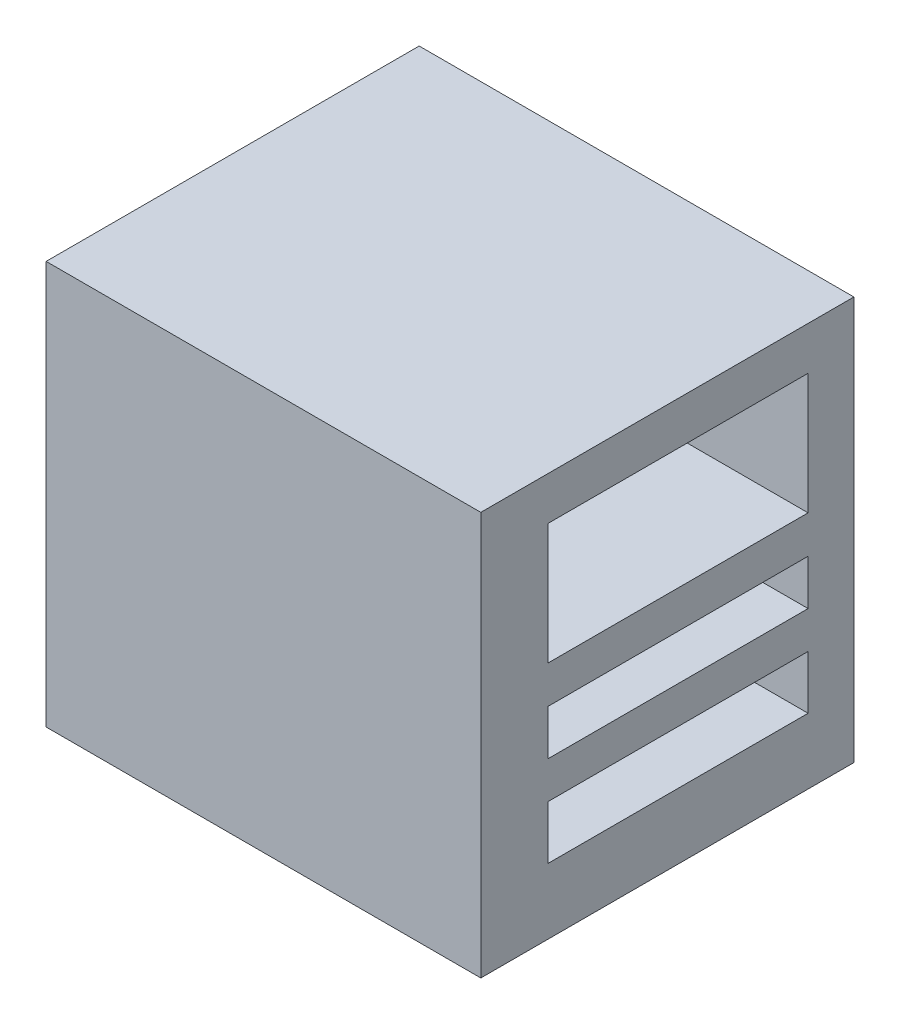
from build123d import *

# Parameters (mm, degrees)
SKETCH1_W           = 85.818697819
SKETCH1_H           = 92.771601577
SKETCH1_W_2         = 59.794972322
SKETCH1_H_2         = 27.811615033
SKETCH1_H_3         = 10.429355638
SKETCH1_H_4         = 12.316572372
BOSS_EXTRUDE1_DEPTH = 100


with BuildPart() as part:
    # Sketch1 → Boss-Extrude1 (new body)
    with BuildSketch(Plane(origin=(0, 0, 0), x_dir=(0, 0, -1), z_dir=(1, 0, 0))):
        with Locations((2.781161504, -10.528682834)):
            Rectangle(SKETCH1_W, SKETCH1_H)
        with Locations((5.264341417, 12.018590783)):
            Rectangle(SKETCH1_W_2, SKETCH1_H_2, mode=Mode.SUBTRACT)
        with Locations((5.264341417, -15.743360653)):
            Rectangle(SKETCH1_W_2, SKETCH1_H_3, mode=Mode.SUBTRACT)
        with Locations((5.264341417, -35.658463561)):
            Rectangle(SKETCH1_W_2, SKETCH1_H_4, mode=Mode.SUBTRACT)
    extrude(amount=BOSS_EXTRUDE1_DEPTH)


solid = part.part
